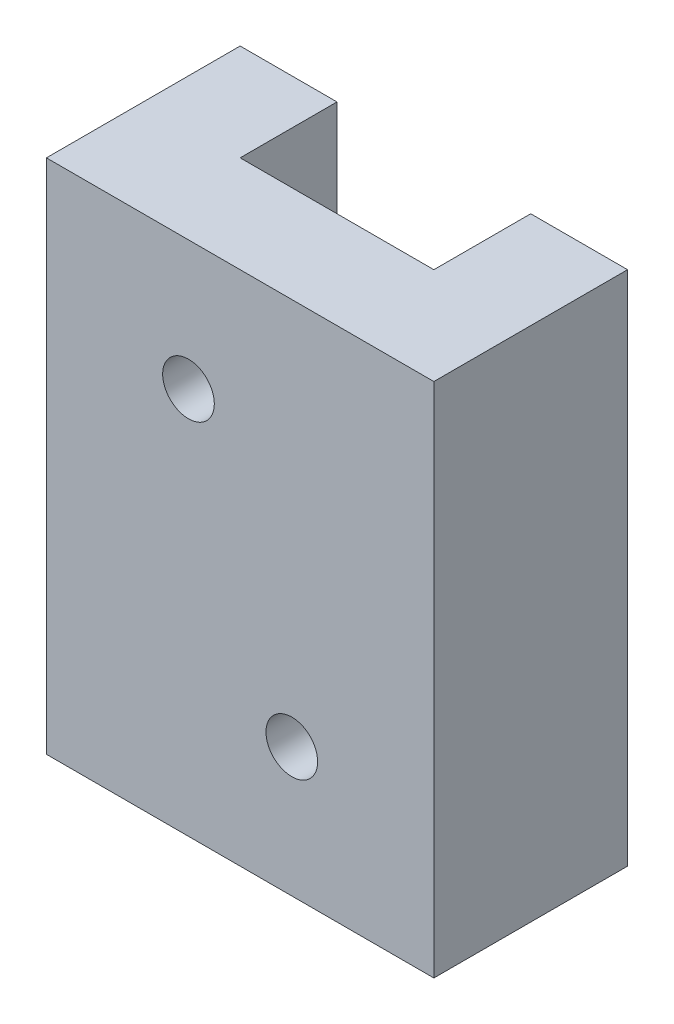
from build123d import *

# Parameters (mm, degrees)
ESQUISSE1_W        = 15
ESQUISSE1_H        = 20
ESQUISSE1_R        = 1
BOSS_EXTRU_1_DEPTH = 3.75
ESQUISSE2_W        = 3.75
ESQUISSE2_H        = 20
BOSS_EXTRU_2_DEPTH = 3.75


with BuildPart() as part:
    # Esquisse1 → Boss.-Extru.1 (new body)
    with BuildSketch(Plane.XY):
        with Locations((0, 10)):
            Rectangle(ESQUISSE1_W, ESQUISSE1_H)
        with Locations((-2, 15)):
            Circle(ESQUISSE1_R, mode=Mode.SUBTRACT)
        with Locations((2, 5)):
            Circle(ESQUISSE1_R, mode=Mode.SUBTRACT)
    extrude(amount=BOSS_EXTRU_1_DEPTH)

    # Esquisse2 → Boss.-Extru.2 (add)
    with BuildSketch(Plane(origin=(0, 0, 0), x_dir=(-1, 0, 0), z_dir=(0, 0, -1))):
        with Locations((5.625, 10)):
            Rectangle(ESQUISSE2_W, ESQUISSE2_H)
        with Locations((-5.625, 10)):
            Rectangle(ESQUISSE2_W, ESQUISSE2_H)
    extrude(amount=BOSS_EXTRU_2_DEPTH)


solid = part.part
